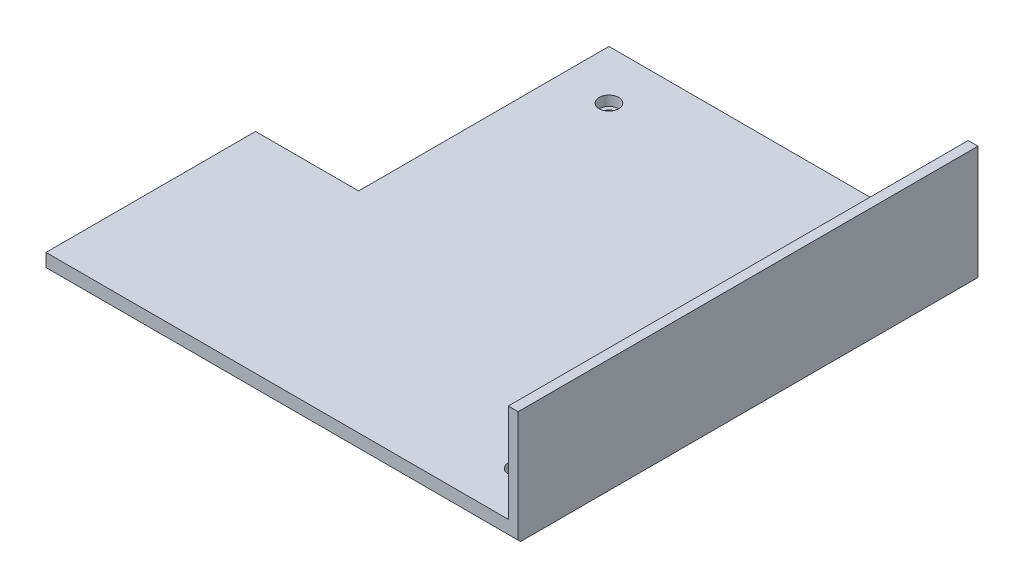
from build123d import *

# Parameters (mm, degrees)
SKETCH1_W                      = 192.4
SKETCH1_H                      = 187.4
BOSS_EXTRUDE1_DEPTH            = 6.35
BOSS_EXTRUDE2_DEPTH            = 40
CUT_EXTRUDE1_REACH             = 142.122
SKETCH4_W                      = 42
SKETCH4_H                      = 102
CBORE_FOR_M4_SHCS1_D           = 4.5
CBORE_FOR_M4_SHCS1_CBORE_D     = 8
CBORE_FOR_M4_SHCS1_CBORE_DEPTH = 4
CHAMFER1_SIZE                  = 1


with BuildPart() as part:
    # Sketch1 → Boss-Extrude1 (new body)
    with BuildSketch(Plane(origin=(0, 0, 0), x_dir=(1, 0, 0), z_dir=(0, 1, 0))):
        Rectangle(SKETCH1_W, SKETCH1_H)
    extrude(amount=BOSS_EXTRUDE1_DEPTH)

    # Sketch2 → Boss-Extrude2 (add)
    with BuildSketch(Plane(origin=(0, 6.35, 0), x_dir=(1, 0, 0), z_dir=(0, 1, 0))):
        Polygon((-92.2, 89.7), (-92.2, -89.7), (-92.2, -93.7), (-96.2, -93.7), (-96.2, 93.7), (-92.2, 93.7), align=None)
    extrude(amount=BOSS_EXTRUDE2_DEPTH)

    # Sketch4 → Cut-Extrude1 (cut, up to next)
    with BuildSketch(Plane(origin=(0, 6.35, 0), x_dir=(1, 0, 0), z_dir=(0, 1, 0)), mode=Mode.PRIVATE) as cut_extrude1_sk1:
        with Locations((75.2, 42.7)):
            Rectangle(SKETCH4_W, SKETCH4_H)
    cut_extrude1_tool1 = extrude(cut_extrude1_sk1.sketch, amount=-CUT_EXTRUDE1_REACH, mode=Mode.PRIVATE) & part.part
    add(cut_extrude1_tool1.solids().sort_by_distance((75.2, 6.35, -42.7))[0], mode=Mode.SUBTRACT)

    # CBORE for M4 SHCS1 (through all)
    with Locations(Plane(origin=(0, 6.35, 0), x_dir=(1, 0, 0), z_dir=(0, 1, 0))):
        with Locations((34.2, 73.7), (-76.2, 73.7), (-76.2, -73.7)):
            CounterBoreHole(CBORE_FOR_M4_SHCS1_D / 2, CBORE_FOR_M4_SHCS1_CBORE_D / 2, CBORE_FOR_M4_SHCS1_CBORE_DEPTH)


with BuildPart() as body_2:
    # Mirror1: mirrored copy
    add(part.part.mirror(Plane(origin=(96.2, 6.35, -93.7), x_dir=(0, 0, 1), z_dir=(-1, 0, 0))))

    # Chamfer1
    chamfer1_edges = [body_2.edges().sort_by_distance(p)[0] for p in [
        (192.4, 0, 93.7),
        (96.2, 0, 51),
    ]]
    chamfer(chamfer1_edges, length=CHAMFER1_SIZE)


solid = body_2.part
